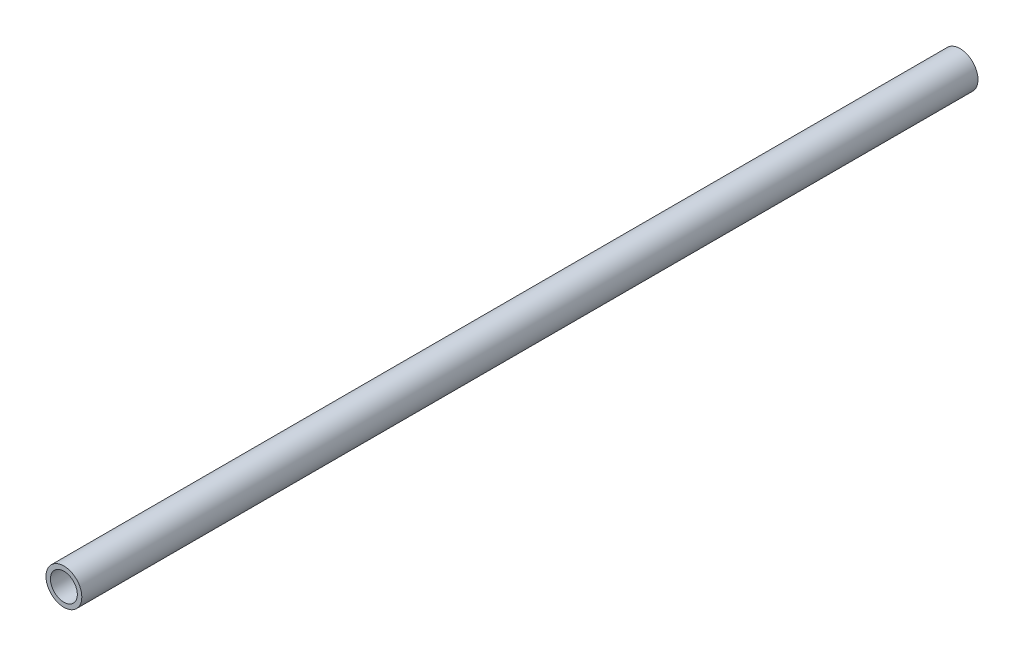
from build123d import *

# Parameters (mm, degrees)
SKETCH1_R           = 5
SKETCH1_R_2         = 3.75
BOSS_EXTRUDE1_DEPTH = 125


with BuildPart() as part:
    # Sketch1 → Boss-Extrude1 (new, symmetric)
    with BuildSketch(Plane.XY):
        Circle(SKETCH1_R)
        Circle(SKETCH1_R_2, mode=Mode.SUBTRACT)
    extrude(amount=BOSS_EXTRUDE1_DEPTH, both=True)


solid = part.part
